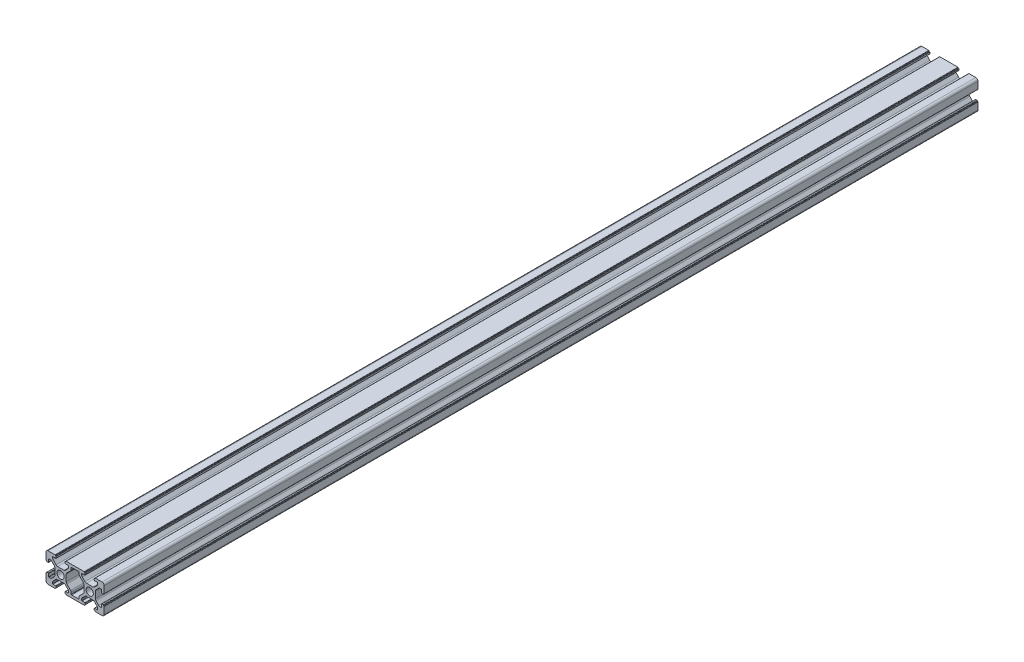
from build123d import *

# Parameters (mm, degrees)
SKETCH1_R           = 2.5
BOSS_EXTRUDE2_DEPTH = 600


with BuildPart() as part:
    # Sketch1 → Boss-Extrude2 (new body)
    with BuildSketch(Plane.XY):
        with BuildLine():
            Line((1.5, 0), (6.2, 0))
            ThreePointArc((6.2, 0), (6.341421356, 0.058578644), (6.4, 0.2))
            Line((6.4, 0.2), (6.4, 0.3))
            ThreePointArc((6.4, 0.3), (6.458578644, 0.441421356), (6.6, 0.5))
            Line((6.6, 0.5), (6.7, 0.5))
            ThreePointArc((6.7, 0.5), (6.841421356, 0.558578644), (6.9, 0.7))
            Line((6.9, 0.7), (6.9, 1.5))
            ThreePointArc((6.9, 1.5), (6.812132034, 1.712132034), (6.6, 1.8))
            Line((6.6, 1.8), (4.8, 1.8))
            ThreePointArc((4.8, 1.8), (4.587867966, 1.887867966), (4.5, 2.1))
            Line((4.5, 2.1), (4.5, 2.818019485))
            ThreePointArc((4.5, 2.818019485), (4.614180701, 3.392044633), (4.939339828, 3.878679656))
            Line((4.939339828, 3.878679656), (6.721320344, 5.660660172))
            ThreePointArc((6.721320344, 5.660660172), (7.207955367, 5.985819299), (7.781980515, 6.1))
            Line((7.781980515, 6.1), (12.218019485, 6.1))
            ThreePointArc((12.218019485, 6.1), (12.792044633, 5.985819299), (13.278679656, 5.660660172))
            Line((13.278679656, 5.660660172), (15.060660172, 3.878679656))
            ThreePointArc((15.060660172, 3.878679656), (15.385819299, 3.392044633), (15.5, 2.818019485))
            Line((15.5, 2.818019485), (15.5, 2.1))
            ThreePointArc((15.5, 2.1), (15.412132034, 1.887867966), (15.2, 1.8))
            Line((15.2, 1.8), (13.4, 1.8))
            ThreePointArc((13.4, 1.8), (13.187867966, 1.712132034), (13.1, 1.5))
            Line((13.1, 1.5), (13.1, 0.7))
            ThreePointArc((13.1, 0.7), (13.158578644, 0.558578644), (13.3, 0.5))
            Line((13.3, 0.5), (13.4, 0.5))
            ThreePointArc((13.4, 0.5), (13.541421356, 0.441421356), (13.6, 0.3))
            Line((13.6, 0.3), (13.6, 0.2))
            ThreePointArc((13.6, 0.2), (13.658578644, 0.058578644), (13.8, 0))
            Line((13.8, 0), (26.2, 0))
            ThreePointArc((26.2, 0), (26.341421356, 0.058578644), (26.4, 0.2))
            Line((26.4, 0.2), (26.4, 0.3))
            ThreePointArc((26.4, 0.3), (26.458578644, 0.441421356), (26.6, 0.5))
            Line((26.6, 0.5), (26.7, 0.5))
            ThreePointArc((26.7, 0.5), (26.841421356, 0.558578644), (26.9, 0.7))
            Line((26.9, 0.7), (26.9, 1.5))
            ThreePointArc((26.9, 1.5), (26.812132034, 1.712132034), (26.6, 1.8))
            Line((26.6, 1.8), (24.8, 1.8))
            ThreePointArc((24.8, 1.8), (24.587867966, 1.887867966), (24.5, 2.1))
            Line((24.5, 2.1), (24.5, 2.818019485))
            ThreePointArc((24.5, 2.818019485), (24.614180701, 3.392044633), (24.939339828, 3.878679656))
            Line((24.939339828, 3.878679656), (26.721320344, 5.660660172))
            ThreePointArc((26.721320344, 5.660660172), (27.207955367, 5.985819299), (27.781980515, 6.1))
            Line((27.781980515, 6.1), (32.218019485, 6.1))
            ThreePointArc((32.218019485, 6.1), (32.792044633, 5.985819299), (33.278679656, 5.660660172))
            Line((33.278679656, 5.660660172), (35.060660172, 3.878679656))
            ThreePointArc((35.060660172, 3.878679656), (35.385819299, 3.392044633), (35.5, 2.818019485))
            Line((35.5, 2.818019485), (35.5, 2.1))
            ThreePointArc((35.5, 2.1), (35.412132034, 1.887867966), (35.2, 1.8))
            Line((35.2, 1.8), (33.4, 1.8))
            ThreePointArc((33.4, 1.8), (33.187867966, 1.712132034), (33.1, 1.5))
            Line((33.1, 1.5), (33.1, 0.7))
            ThreePointArc((33.1, 0.7), (33.158578644, 0.558578644), (33.3, 0.5))
            Line((33.3, 0.5), (33.4, 0.5))
            ThreePointArc((33.4, 0.5), (33.541421356, 0.441421356), (33.6, 0.3))
            Line((33.6, 0.3), (33.6, 0.2))
            ThreePointArc((33.6, 0.2), (33.658578644, 0.058578644), (33.8, 0))
            Line((33.8, 0), (38.5, 0))
            ThreePointArc((38.5, 0), (39.560660172, 0.439339828), (40, 1.5))
            Line((40, 1.5), (40, 6.2))
            ThreePointArc((40, 6.2), (39.941421356, 6.341421356), (39.8, 6.4))
            Line((39.8, 6.4), (39.7, 6.4))
            ThreePointArc((39.7, 6.4), (39.558578644, 6.458578644), (39.5, 6.6))
            Line((39.5, 6.6), (39.5, 6.7))
            ThreePointArc((39.5, 6.7), (39.441421356, 6.841421356), (39.3, 6.9))
            Line((39.3, 6.9), (38.5, 6.9))
            ThreePointArc((38.5, 6.9), (38.287867966, 6.812132034), (38.2, 6.6))
            Line((38.2, 6.6), (38.2, 4.8))
            ThreePointArc((38.2, 4.8), (38.112132034, 4.587867966), (37.9, 4.5))
            Line((37.9, 4.5), (37.181980515, 4.5))
            ThreePointArc((37.181980515, 4.5), (36.607955367, 4.614180701), (36.121320344, 4.939339828))
            Line((36.121320344, 4.939339828), (34.339339828, 6.721320344))
            ThreePointArc((34.339339828, 6.721320344), (34.014180701, 7.207955367), (33.9, 7.781980515))
            Line((33.9, 7.781980515), (33.9, 12.218019485))
            ThreePointArc((33.9, 12.218019485), (34.014180701, 12.792044633), (34.339339828, 13.278679656))
            Line((34.339339828, 13.278679656), (36.121320344, 15.060660172))
            ThreePointArc((36.121320344, 15.060660172), (36.607955367, 15.385819299), (37.181980515, 15.5))
            Line((37.181980515, 15.5), (37.9, 15.5))
            ThreePointArc((37.9, 15.5), (38.112132034, 15.412132034), (38.2, 15.2))
            Line((38.2, 15.2), (38.2, 13.4))
            ThreePointArc((38.2, 13.4), (38.287867966, 13.187867966), (38.5, 13.1))
            Line((38.5, 13.1), (39.3, 13.1))
            ThreePointArc((39.3, 13.1), (39.441421356, 13.158578644), (39.5, 13.3))
            Line((39.5, 13.3), (39.5, 13.4))
            ThreePointArc((39.5, 13.4), (39.558578644, 13.541421356), (39.7, 13.6))
            Line((39.7, 13.6), (39.8, 13.6))
            ThreePointArc((39.8, 13.6), (39.941421356, 13.658578644), (40, 13.8))
            Line((40, 13.8), (40, 18.5))
            ThreePointArc((40, 18.5), (39.560660172, 19.560660172), (38.5, 20))
            Line((38.5, 20), (33.8, 20))
            ThreePointArc((33.8, 20), (33.658578644, 19.941421356), (33.6, 19.8))
            Line((33.6, 19.8), (33.6, 19.7))
            ThreePointArc((33.6, 19.7), (33.541421356, 19.558578644), (33.4, 19.5))
            Line((33.4, 19.5), (33.3, 19.5))
            ThreePointArc((33.3, 19.5), (33.158578644, 19.441421356), (33.1, 19.3))
            Line((33.1, 19.3), (33.1, 18.5))
            ThreePointArc((33.1, 18.5), (33.187867966, 18.287867966), (33.4, 18.2))
            Line((33.4, 18.2), (35.2, 18.2))
            ThreePointArc((35.2, 18.2), (35.412132034, 18.112132034), (35.5, 17.9))
            Line((35.5, 17.9), (35.5, 17.181980515))
            ThreePointArc((35.5, 17.181980515), (35.385819299, 16.607955367), (35.060660172, 16.121320344))
            Line((35.060660172, 16.121320344), (33.278679656, 14.339339828))
            ThreePointArc((33.278679656, 14.339339828), (32.792044633, 14.014180701), (32.218019485, 13.9))
            Line((32.218019485, 13.9), (27.781980515, 13.9))
            ThreePointArc((27.781980515, 13.9), (27.207955367, 14.014180701), (26.721320344, 14.339339828))
            Line((26.721320344, 14.339339828), (24.939339828, 16.121320344))
            ThreePointArc((24.939339828, 16.121320344), (24.614180701, 16.607955367), (24.5, 17.181980515))
            Line((24.5, 17.181980515), (24.5, 17.9))
            ThreePointArc((24.5, 17.9), (24.587867966, 18.112132034), (24.8, 18.2))
            Line((24.8, 18.2), (26.6, 18.2))
            ThreePointArc((26.6, 18.2), (26.812132034, 18.287867966), (26.9, 18.5))
            Line((26.9, 18.5), (26.9, 19.3))
            ThreePointArc((26.9, 19.3), (26.841421356, 19.441421356), (26.7, 19.5))
            Line((26.7, 19.5), (26.6, 19.5))
            ThreePointArc((26.6, 19.5), (26.458578644, 19.558578644), (26.4, 19.7))
            Line((26.4, 19.7), (26.4, 19.8))
            ThreePointArc((26.4, 19.8), (26.341421356, 19.941421356), (26.2, 20))
            Line((26.2, 20), (13.8, 20))
            ThreePointArc((13.8, 20), (13.658578644, 19.941421356), (13.6, 19.8))
            Line((13.6, 19.8), (13.6, 19.7))
            ThreePointArc((13.6, 19.7), (13.541421356, 19.558578644), (13.4, 19.5))
            Line((13.4, 19.5), (13.3, 19.5))
            ThreePointArc((13.3, 19.5), (13.158578644, 19.441421356), (13.1, 19.3))
            Line((13.1, 19.3), (13.1, 18.2))
            Line((13.1, 18.2), (15.3, 18.2))
            ThreePointArc((15.3, 18.2), (15.512132034, 18.112132034), (15.6, 17.9))
            Line((15.6, 17.9), (15.6, 17.281980515))
            ThreePointArc((15.6, 17.281980515), (15.485819299, 16.707955367), (15.160660172, 16.221320344))
            Line((15.160660172, 16.221320344), (13.278679656, 14.339339828))
            ThreePointArc((13.278679656, 14.339339828), (12.792044633, 14.014180701), (12.218019485, 13.9))
            Line((12.218019485, 13.9), (7.986375635, 13.9))
            ThreePointArc((7.986375635, 13.9), (7.393381044, 14.022191082), (6.896997987, 14.36885678))
            Line((6.896997987, 14.36885678), (4.910622352, 16.467414163))
            ThreePointArc((4.910622352, 16.467414163), (4.606431474, 16.943609851), (4.5, 17.498557383))
            Line((4.5, 17.498557383), (4.5, 17.9))
            ThreePointArc((4.5, 17.9), (4.587867966, 18.112132034), (4.8, 18.2))
            Line((4.8, 18.2), (6.9, 18.2))
            Line((6.9, 18.2), (6.9, 19.3))
            ThreePointArc((6.9, 19.3), (6.841421356, 19.441421356), (6.7, 19.5))
            Line((6.7, 19.5), (6.6, 19.5))
            ThreePointArc((6.6, 19.5), (6.458578644, 19.558578644), (6.4, 19.7))
            Line((6.4, 19.7), (6.4, 19.8))
            ThreePointArc((6.4, 19.8), (6.341421356, 19.941421356), (6.2, 20))
            Line((6.2, 20), (1.5, 20))
            ThreePointArc((1.5, 20), (0.439339828, 19.560660172), (0, 18.5))
            Line((0, 18.5), (0, 13.8))
            ThreePointArc((0, 13.8), (0.058578644, 13.658578644), (0.2, 13.6))
            Line((0.2, 13.6), (0.3, 13.6))
            ThreePointArc((0.3, 13.6), (0.441421356, 13.541421356), (0.5, 13.4))
            Line((0.5, 13.4), (0.5, 13.3))
            ThreePointArc((0.5, 13.3), (0.558578644, 13.158578644), (0.7, 13.1))
            Line((0.7, 13.1), (1.5, 13.1))
            ThreePointArc((1.5, 13.1), (1.712132034, 13.187867966), (1.8, 13.4))
            Line((1.8, 13.4), (1.8, 15.2))
            ThreePointArc((1.8, 15.2), (1.887867966, 15.412132034), (2.1, 15.5))
            Line((2.1, 15.5), (2.818019485, 15.5))
            ThreePointArc((2.818019485, 15.5), (3.392044633, 15.385819299), (3.878679656, 15.060660172))
            Line((3.878679656, 15.060660172), (5.660660172, 13.278679656))
            ThreePointArc((5.660660172, 13.278679656), (5.985819299, 12.792044633), (6.1, 12.218019485))
            Line((6.1, 12.218019485), (6.1, 7.781980515))
            ThreePointArc((6.1, 7.781980515), (5.985819299, 7.207955367), (5.660660172, 6.721320344))
            Line((5.660660172, 6.721320344), (3.878679656, 4.939339828))
            ThreePointArc((3.878679656, 4.939339828), (3.392044633, 4.614180701), (2.818019485, 4.5))
            Line((2.818019485, 4.5), (2.1, 4.5))
            ThreePointArc((2.1, 4.5), (1.887867966, 4.587867966), (1.8, 4.8))
            Line((1.8, 4.8), (1.8, 6.6))
            ThreePointArc((1.8, 6.6), (1.712132034, 6.812132034), (1.5, 6.9))
            Line((1.5, 6.9), (0.7, 6.9))
            ThreePointArc((0.7, 6.9), (0.558578644, 6.841421356), (0.5, 6.7))
            Line((0.5, 6.7), (0.5, 6.6))
            ThreePointArc((0.5, 6.6), (0.441421356, 6.458578644), (0.3, 6.4))
            Line((0.3, 6.4), (0.2, 6.4))
            ThreePointArc((0.2, 6.4), (0.058578644, 6.341421356), (0, 6.2))
            Line((0, 6.2), (0, 1.5))
            ThreePointArc((0, 1.5), (0.439339828, 0.439339828), (1.5, 0))
        make_face()
        with Locations((10, 10)):
            Circle(SKETCH1_R, mode=Mode.SUBTRACT)
        with Locations((30, 10)):
            Circle(SKETCH1_R, mode=Mode.SUBTRACT)
        with BuildLine():
            Line((17.6, 1.8), (22.4, 1.8))
            ThreePointArc((22.4, 1.8), (22.612132034, 1.887867966), (22.7, 2.1))
            Line((22.7, 2.1), (22.7, 3.139339828))
            ThreePointArc((22.7, 3.139339828), (22.814180701, 3.713364977), (23.139339828, 4.2))
            Line((23.139339828, 4.2), (25.660660172, 6.721320344))
            ThreePointArc((25.660660172, 6.721320344), (25.985819299, 7.207955367), (26.1, 7.781980515))
            Line((26.1, 7.781980515), (26.1, 12.218019485))
            ThreePointArc((26.1, 12.218019485), (25.985819299, 12.792044633), (25.660660172, 13.278679656))
            Line((25.660660172, 13.278679656), (23.139339828, 15.8))
            ThreePointArc((23.139339828, 15.8), (22.814180701, 16.286635023), (22.7, 16.860660172))
            Line((22.7, 16.860660172), (22.7, 17.9))
            ThreePointArc((22.7, 17.9), (22.612132034, 18.112132034), (22.4, 18.2))
            Line((22.4, 18.2), (17.6, 18.2))
            ThreePointArc((17.6, 18.2), (17.387867966, 18.112132034), (17.3, 17.9))
            Line((17.3, 17.9), (17.3, 16.860660172))
            ThreePointArc((17.3, 16.860660172), (17.185819299, 16.286635023), (16.860660172, 15.8))
            Line((16.860660172, 15.8), (14.339339828, 13.278679656))
            ThreePointArc((14.339339828, 13.278679656), (14.014180701, 12.792044633), (13.9, 12.218019485))
            Line((13.9, 12.218019485), (13.9, 7.781980515))
            ThreePointArc((13.9, 7.781980515), (14.014180701, 7.207955367), (14.339339828, 6.721320344))
            Line((14.339339828, 6.721320344), (16.860660172, 4.2))
            ThreePointArc((16.860660172, 4.2), (17.185819299, 3.713364977), (17.3, 3.139339828))
            Line((17.3, 3.139339828), (17.3, 2.1))
            ThreePointArc((17.3, 2.1), (17.387867966, 1.887867966), (17.6, 1.8))
        make_face(mode=Mode.SUBTRACT)
    extrude(amount=BOSS_EXTRUDE2_DEPTH)


solid = part.part
